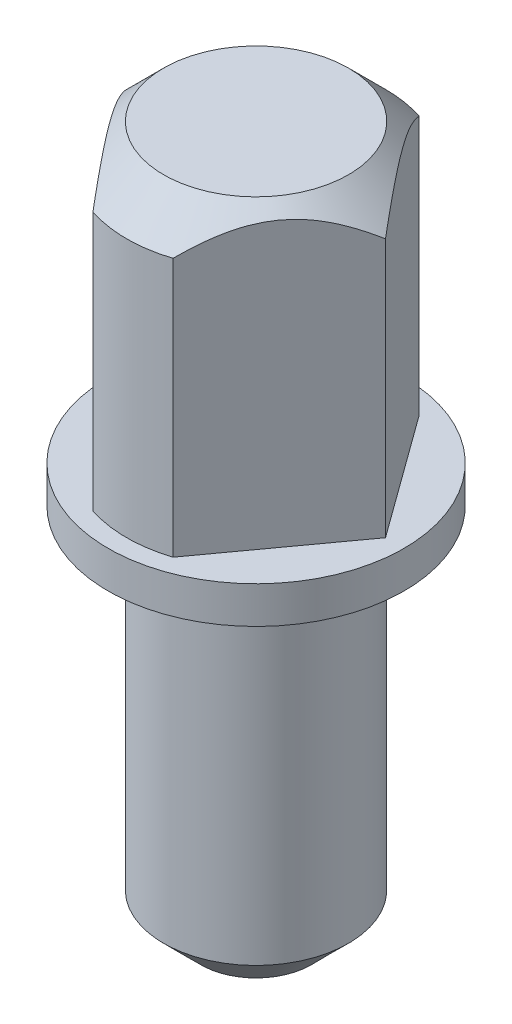
from build123d import *

# Parameters (mm, degrees)
SKETCH_2_R          = 6.282667793
CUT_EXTRUDE_2_DEPTH = 8


with BuildPart() as part:
    # 草图1 → 旋转1 (revolve)
    with BuildSketch(Plane.XY, mode=Mode.PRIVATE) as revolve_1_sk:
        Polygon((0, 0), (0, 19), (2.5, 19), (3.5, 18), (3.5, 11), (4, 11), (4, 10), (2.5, 10), (2.5, 1), (1.5, 0), align=None)
    revolve(revolve_1_sk.sketch.rotate(Axis((0, 0, 0), (0, 1, 0)), 90), axis=Axis((0, 0, 0), (0, 1, 0)))

    # 草图2 → 切除-拉伸2 (cut)
    with BuildSketch(Plane(origin=(0, 19, 0), x_dir=(1, 0, 0), z_dir=(0, 1, 0))):
        Circle(SKETCH_2_R)
        Polygon((0, 4.820824702), (-3.5, 0), (0, -4.820824702), (3.5, 0), align=None, mode=Mode.SUBTRACT)
    extrude(amount=-CUT_EXTRUDE_2_DEPTH, mode=Mode.SUBTRACT)


solid = part.part
